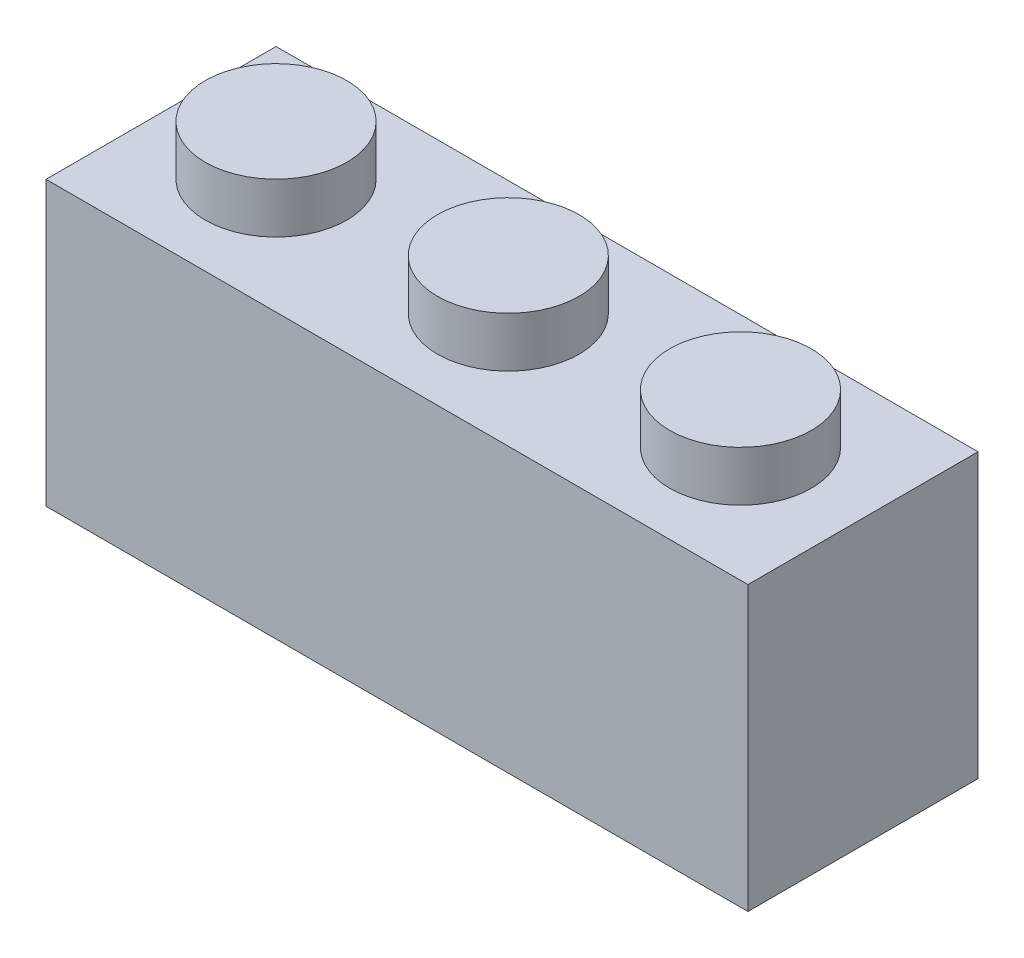
from build123d import *

# Parameters (mm, degrees)
SKETCH_1_W          = 23.8
SKETCH_1_H          = 7.8
EXTRUDE_2_DEPTH     = 9.6
SKETCH_3_R          = 2.4
EXTRUDE_3_DEPTH     = 1.7
SKETCH_4_R          = 2.5
CUT_EXTRUDE_1_DEPTH = 1.8


with BuildPart() as part:
    # Эскиз1 → Бобышка-Вытянуть2 (new body)
    with BuildSketch(Plane(origin=(0, 0, 0), x_dir=(1, 0, 0), z_dir=(0, 1, 0))):
        Rectangle(SKETCH_1_W, SKETCH_1_H)
    extrude(amount=EXTRUDE_2_DEPTH)

    # Эскиз3 → Бобышка-Вытянуть3 (add)
    with BuildSketch(Plane(origin=(0, 9.6, 0), x_dir=(1, 0, 0), z_dir=(0, 1, 0))):
        with Locations(Location((-8, 0, 0), (0, 0, 270))):
            Circle(SKETCH_3_R)
        with Locations(Location((-0.126, 0, 0), (0, 0, 270))):
            Circle(SKETCH_3_R)
        with Locations(Location((7.748, 0, 0), (0, 0, 270))):
            Circle(SKETCH_3_R)
    extrude(amount=EXTRUDE_3_DEPTH)

    # Эскиз4 → Вырез-Вытянуть1 (cut)
    with BuildSketch(Plane.XZ):
        with Locations(Location((-8, 0, 0), (0, 0, 270))):
            Circle(SKETCH_4_R)
        with Locations(Location((-0.126, 0, 0), (0, 0, 270))):
            Circle(SKETCH_4_R)
        with Locations(Location((7.748, 0, 0), (0, 0, 270))):
            Circle(SKETCH_4_R)
    extrude(amount=-CUT_EXTRUDE_1_DEPTH, mode=Mode.SUBTRACT)


solid = part.part
